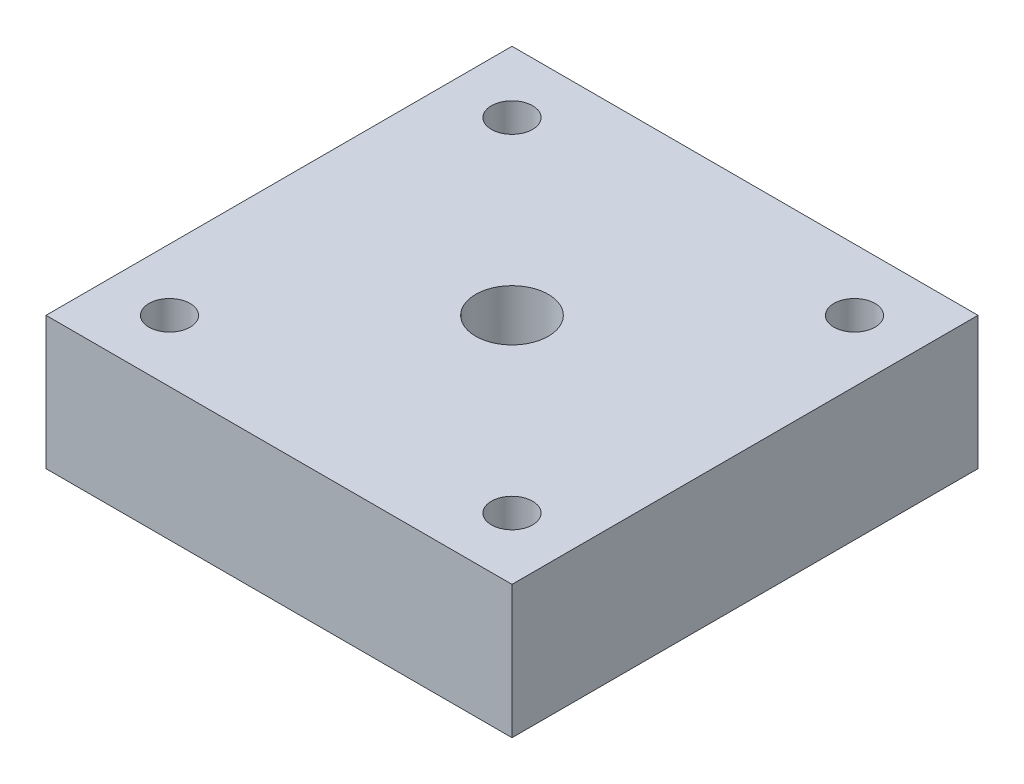
from build123d import *

# Parameters (mm, degrees)
SKETCH1_W                           = 96.210678118
SKETCH1_H                           = 96.210678118
SKETCH1_R                           = 4.25
BODY_EXTRUSION_AND_BOLT_HOLES_DEPTH = 27.425488446
SKETCH3_R                           = 7.5
ENTRANCE_DEPTH                      = 27.425488446
SKETCH5_R                           = 3.175
OUTLET_DEPTH                        = 100


with BuildPart() as part:
    # Sketch1 → body extrusion and bolt holes (new body)
    with BuildSketch(Plane(origin=(0, 0, 0), x_dir=(1, 0, 0), z_dir=(0, 1, 0))):
        Rectangle(SKETCH1_W, SKETCH1_H)
        with Locations(Location((-35.355339059, 35.355339059, 0), (0, 0, 270))):
            Circle(SKETCH1_R, mode=Mode.SUBTRACT)
        with Locations(Location((35.355339059, 35.355339059, 0), (0, 0, 270))):
            Circle(SKETCH1_R, mode=Mode.SUBTRACT)
        with Locations(Location((35.355339059, -35.355339059, 0), (0, 0, 270))):
            Circle(SKETCH1_R, mode=Mode.SUBTRACT)
        with Locations(Location((-35.355339059, -35.355339059, 0), (0, 0, 270))):
            Circle(SKETCH1_R, mode=Mode.SUBTRACT)
    extrude(amount=BODY_EXTRUSION_AND_BOLT_HOLES_DEPTH)

    # Sketch2 → main chamber (revolve, cut)
    with BuildSketch(Plane.XY):
        Polygon((0, 0), (0, 19.425488446), (22.725, 9.85), (22.725, 0), align=None)
    revolve(axis=Axis((0, 0, 0), (0, 1, 0)), mode=Mode.SUBTRACT)

    # Sketch3 → entrance (cut)
    with BuildSketch(Plane(origin=(0, 27.425488446, 0), x_dir=(1, 0, 0), z_dir=(0, 1, 0))):
        with Locations(Location((0, 0, 0), (0, 0, 270))):
            Circle(SKETCH3_R)
    extrude(amount=-ENTRANCE_DEPTH, mode=Mode.SUBTRACT)

    # Sketch5 → outlet (cut)
    with BuildSketch(Plane(origin=(0, 0, 0), x_dir=(0, 0, -1), z_dir=(1, 0, 0))):
        with Locations((-19.55, 6.675)):
            Circle(SKETCH5_R)
    extrude(amount=-OUTLET_DEPTH, mode=Mode.SUBTRACT)


solid = part.part
